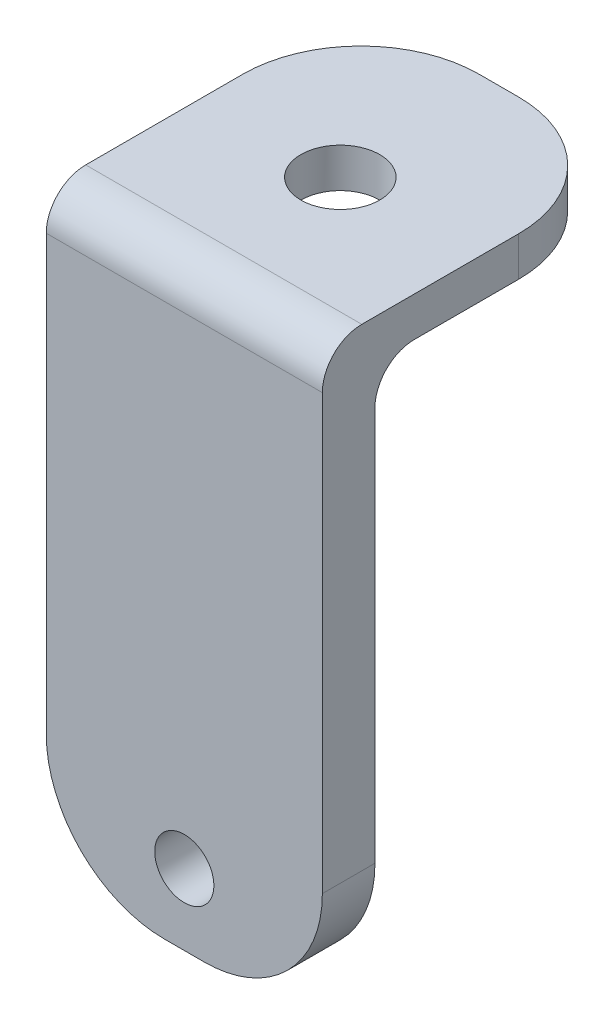
from build123d import *

# Parameters (mm, degrees)
BOSS_EXTRUDE1_DEPTH      = 35
BOSS_EXTRUDE1_DEPTH_BACK = 35
SKETCH2_R                = 10
CUT_EXTRUDE1_DEPTH       = 35
SKETCH3_R                = 7.5
CUT_EXTRUDE2_DEPTH       = 228.558245926
FILLET1_R                = 30
FILLET2_R                = 10


with BuildPart() as part:
    # Sketch1 → Boss-Extrude1 (new, two sides: drawn at the far end of the back side and taken through both)
    with BuildSketch(Plane(origin=(0, 0, 0), x_dir=(0, 0, -1), z_dir=(1, 0, 0)).offset(-BOSS_EXTRUDE1_DEPTH_BACK)):
        Polygon((-42.056921018, 166.399972685), (-42.056921018, 60.21769331), (-28.717037647, 60.21769331), (-28.717037647, 200.21769331), (37.732030022, 200.21769331), (37.732030022, 210.21769331), (-42.056921018, 210.21769331), align=None)
    extrude(amount=BOSS_EXTRUDE1_DEPTH + BOSS_EXTRUDE1_DEPTH_BACK)

    # Sketch2 → Cut-Extrude1 (cut)
    with BuildSketch(Plane(origin=(0, 210.21769331, 0), x_dir=(1, 0, 0), z_dir=(0, 1, 0))):
        with Locations(Location((0, -2.5, 0), (0, 0, 270))):
            Circle(SKETCH2_R)
    extrude(amount=-CUT_EXTRUDE1_DEPTH, mode=Mode.SUBTRACT)

    # Sketch3 → Cut-Extrude2 (cut, through all)
    with BuildSketch(Plane.XY.offset(42.056921018)):
        with Locations((0, 78.21769331)):
            Circle(SKETCH3_R)
    extrude(amount=-CUT_EXTRUDE2_DEPTH, mode=Mode.SUBTRACT)

    # Fillet1
    fillet1_edges = [part.edges().sort_by_distance(p)[0] for p in [
        (-35, 60.21769331, 35.386979332),
        (35, 60.21769331, 35.386979332),
        (35, 205.21769331, -37.732030022),
        (-35, 205.21769331, -37.732030022),
    ]]
    fillet(fillet1_edges, radius=FILLET1_R)

    # Fillet2
    fillet2_edges = [part.edges().sort_by_distance(p)[0] for p in [
        (0, 210.21769331, 42.056921018),
        (0, 200.21769331, 28.717037647),
    ]]
    fillet(fillet2_edges, radius=FILLET2_R)


solid = part.part
